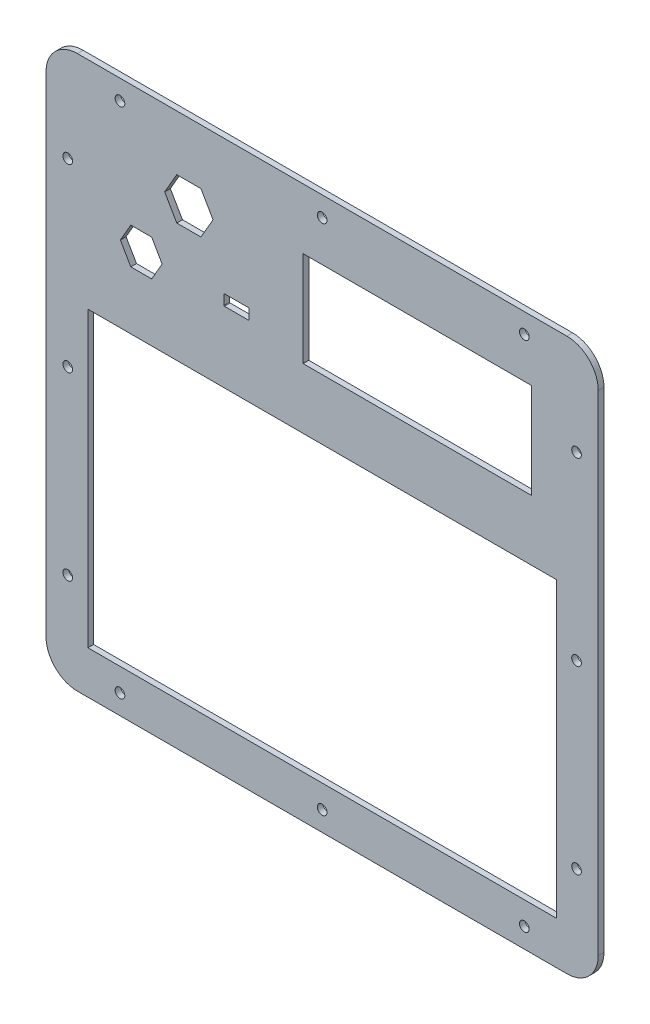
from build123d import *

# Parameters (mm, degrees)
SKETCH3_W           = 246
SKETCH3_H           = 154
SKETCH3_W_2         = 120
SKETCH3_H_2         = 50
BOSS_EXTRUDE1_DEPTH = 3
SKETCH4_R           = 2.54
CUT_EXTRUDE1_DEPTH  = 47.752


with BuildPart() as part:
    # Sketch3 → Boss-Extrude1 (new body)
    with BuildSketch(Plane.XY):
        with BuildLine():
            Line((-128.49, -145), (128.49, -145))
            ThreePointArc((128.49, -145), (140.164332957, -140.164332957), (145, -128.49))
            Line((145, -128.49), (145, 128.49))
            ThreePointArc((145, 128.49), (140.164332957, 140.164332957), (128.49, 145))
            Line((128.49, 145), (-128.49, 145))
            ThreePointArc((-128.49, 145), (-140.164332957, 140.164332957), (-145, 128.49))
            Line((-145, 128.49), (-145, -128.49))
            ThreePointArc((-145, -128.49), (-140.164332957, -140.164332957), (-128.49, -145))
        make_face()
        with Locations((0, -45.5)):
            Rectangle(SKETCH3_W, SKETCH3_H, mode=Mode.SUBTRACT)
        with BuildLine():
            Line((-38.77, 74.35), (-51.23, 74.35))
            ThreePointArc((-51.23, 74.35), (-51.449203102, 74.259203102), (-51.54, 74.04))
            Line((-51.54, 74.04), (-51.54, 68.96))
            ThreePointArc((-51.54, 68.96), (-51.449203102, 68.740796898), (-51.23, 68.65))
            Line((-51.23, 68.65), (-38.77, 68.65))
            ThreePointArc((-38.77, 68.65), (-38.550796898, 68.740796898), (-38.46, 68.96))
            Line((-38.46, 68.96), (-38.46, 74.04))
            ThreePointArc((-38.46, 74.04), (-38.550796898, 74.259203102), (-38.77, 74.35))
        make_face(mode=Mode.SUBTRACT)
        with Locations((50, 88.25)):
            Rectangle(SKETCH3_W_2, SKETCH3_H_2, mode=Mode.SUBTRACT)
        Polygon((-57.298294078, 105), (-63.649147039, 116), (-76.350852961, 116), (-82.701705922, 105), (-76.350852961, 94), (-63.649147039, 94), align=None, mode=Mode.SUBTRACT)
        Polygon((-84.030344885, 71.5), (-89.515172443, 81), (-100.484827557, 81), (-105.969655115, 71.5), (-100.484827557, 62), (-89.515172443, 62), align=None, mode=Mode.SUBTRACT)
    extrude(amount=-BOSS_EXTRUDE1_DEPTH)

    # Sketch4 → Cut-Extrude1 (cut)
    with BuildSketch(Plane.XY):
        with Locations((-133.604, 94.742)):
            Circle(SKETCH4_R)
        with Locations((-106.172, 134.62)):
            Circle(SKETCH4_R)
        with Locations((-133.604, -94.742)):
            Circle(SKETCH4_R)
        with Locations((-133.604, 0)):
            Circle(SKETCH4_R)
        with Locations((0, 134.62)):
            Circle(SKETCH4_R)
        with Locations((0, -134.62)):
            Circle(SKETCH4_R)
        with Locations((-106.172, -134.62)):
            Circle(SKETCH4_R)
        with Locations((106.172, -134.62)):
            Circle(SKETCH4_R)
        with Locations((133.604, 0)):
            Circle(SKETCH4_R)
        with Locations((133.604, -94.742)):
            Circle(SKETCH4_R)
        with Locations((106.172, 134.62)):
            Circle(SKETCH4_R)
        with Locations((133.604, 94.742)):
            Circle(SKETCH4_R)
    extrude(amount=-CUT_EXTRUDE1_DEPTH, mode=Mode.SUBTRACT)


solid = part.part
